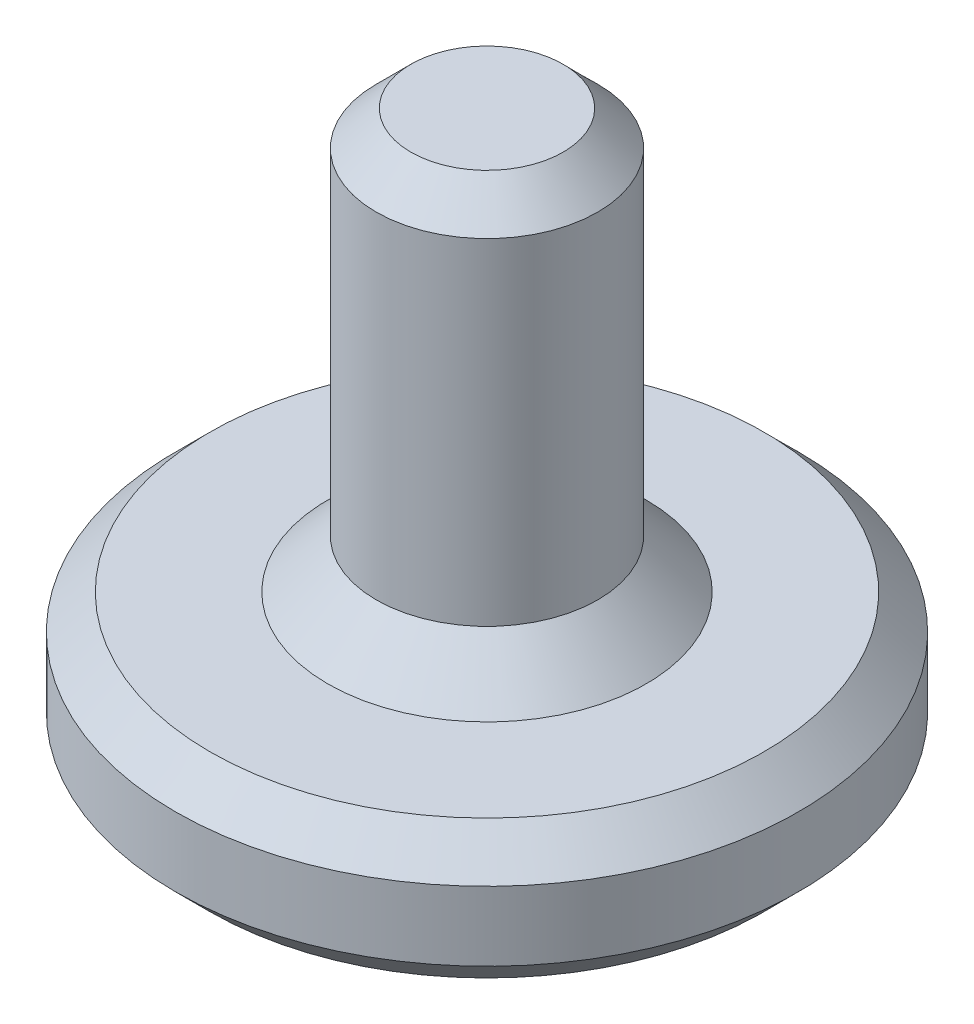
from build123d import *

# Parameters (mm, degrees)
SKETCH1_R           = 4.5
SKETCH1_R_2         = 1.6
BOSS_EXTRUDE1_DEPTH = 2
SKETCH1_2_R         = 1.6
BOSS_EXTRUDE2_DEPTH = 8.05
CHAMFER1_SIZE       = 0.7
CHAMFER2_SIZE       = 0.5
CHAMFER3_SIZE       = 0.5


with BuildPart() as part:
    # Sketch1 → Boss-Extrude1 (new body)
    with BuildSketch(Plane(origin=(0, 0, 0), x_dir=(1, 0, 0), z_dir=(0, 1, 0))):
        Circle(SKETCH1_R)
        Circle(SKETCH1_R_2, mode=Mode.SUBTRACT)
    extrude(amount=BOSS_EXTRUDE1_DEPTH)

    # Sketch1<2> → Boss-Extrude2 (add)
    with BuildSketch(Plane(origin=(0, 0, 0), x_dir=(1, 0, 0), z_dir=(0, 1, 0))):
        Circle(SKETCH1_2_R)
    extrude(amount=BOSS_EXTRUDE2_DEPTH)

    # Chamfer1
    chamfer1_edges = [part.edges().sort_by_distance(p)[0] for p in [
        (-1.6, 2, 0),
    ]]
    chamfer(chamfer1_edges, length=CHAMFER1_SIZE)

    # Chamfer2
    chamfer2_edges = [part.edges().sort_by_distance(p)[0] for p in [
        (-4.5, 2, 0),
        (-4.5, 0, 0),
    ]]
    chamfer(chamfer2_edges, length=CHAMFER2_SIZE)

    # Chamfer3
    chamfer3_edges = [part.edges().sort_by_distance(p)[0] for p in [
        (-1.6, 8.05, 0),
    ]]
    chamfer(chamfer3_edges, length=CHAMFER3_SIZE)


solid = part.part
